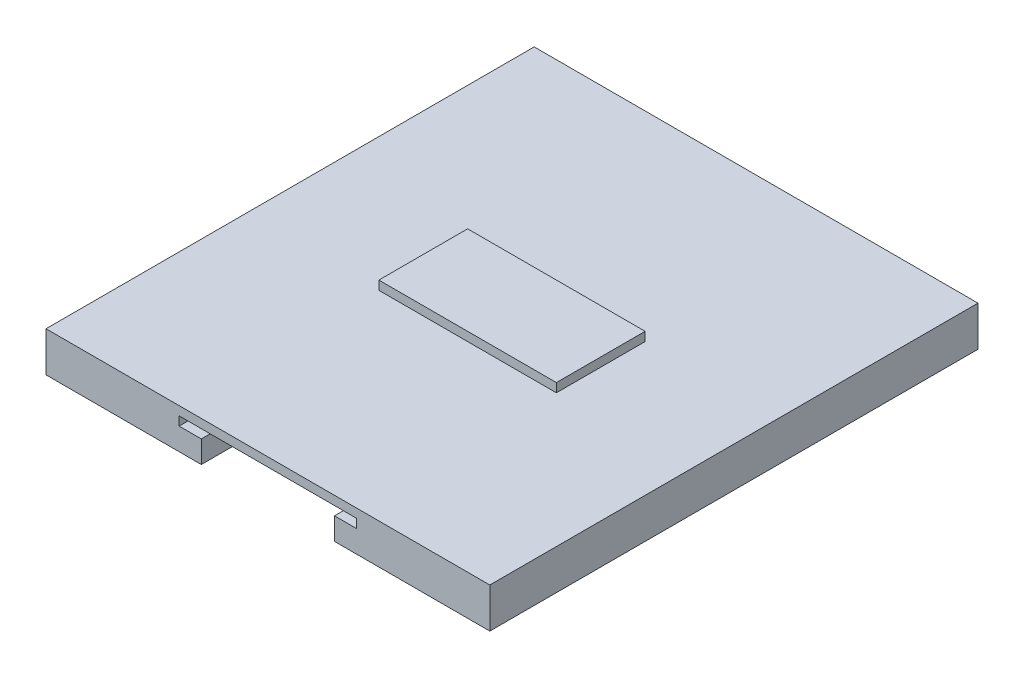
from build123d import *

# Parameters (mm, degrees)
SKETCH2_W          = 100
SKETCH2_H          = 9
EXTRUDE1_DEPTH     = 55
CUT_EXTRUDE1_DEPTH = 122.165176515
SKETCH7_W          = 40
SKETCH7_H          = 20
EXTRUDE2_DEPTH     = 2


with BuildPart() as part:
    # Sketch2 → Extrude1 (new, symmetric)
    with BuildSketch(Plane(origin=(0, 0, 0), x_dir=(-1, 0, 0), z_dir=(0, 0, -1))):
        with Locations((0, 4.5)):
            Rectangle(SKETCH2_W, SKETCH2_H)
    extrude(amount=EXTRUDE1_DEPTH, both=True)

    # Sketch5 → Cut-Extrude1 (cut, through all)
    with BuildSketch(Plane(origin=(0, 0, -55), x_dir=(-1, 0, 0), z_dir=(0, 0, -1))):
        Polygon((20, 5), (20, 7), (-20, 7), (-20, 5), (-15, 5), (-15, 0), (15, 0), (15, 5), align=None)
    extrude(amount=-CUT_EXTRUDE1_DEPTH, mode=Mode.SUBTRACT)

    # Sketch7 → Extrude2 (add)
    with BuildSketch(Plane(origin=(0, 9, 0), x_dir=(1, 0, 0), z_dir=(0, 1, 0))):
        Rectangle(SKETCH7_W, SKETCH7_H)
    extrude(amount=EXTRUDE2_DEPTH)


solid = part.part
